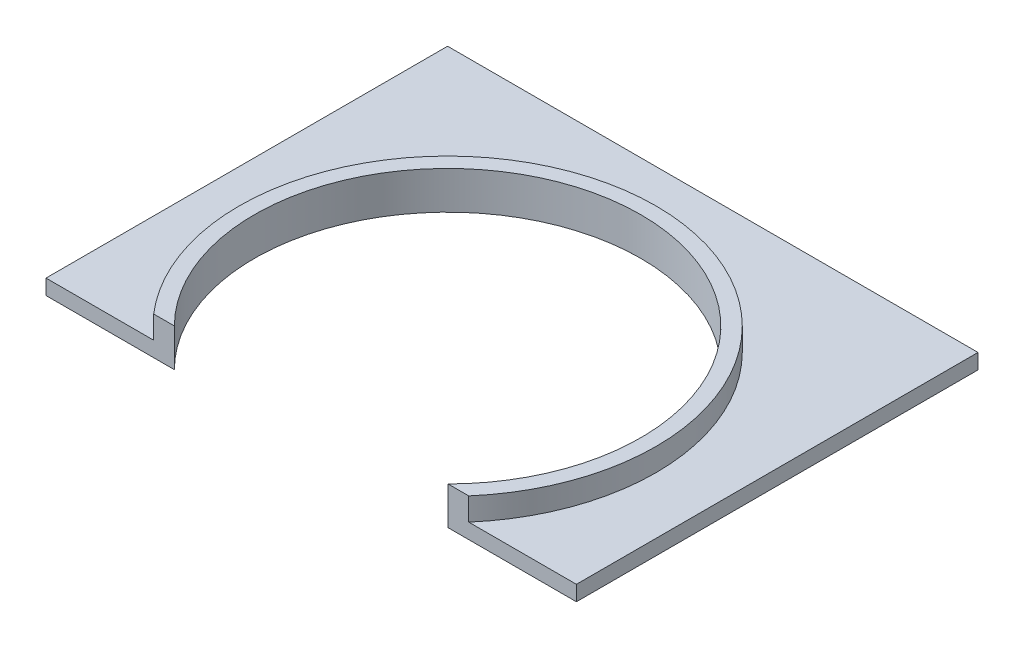
from build123d import *

# Parameters (mm, degrees)
CROQUIS1_W              = 70
CROQUIS1_H              = 70
CROQUIS1_R              = 25.5
SALIENTE_EXTRUIR1_DEPTH = 2
CROQUIS2_R              = 27.5
CROQUIS2_R_2            = 25.5
SALIENTE_EXTRUIR2_DEPTH = 3
CROQUIS3_W              = 70
CROQUIS3_H              = 17
CORTAR_EXTRUIR1_DEPTH   = 50.749371855


with BuildPart() as part:
    # Croquis1 → Saliente-Extruir1 (new body)
    with BuildSketch(Plane(origin=(0, 0, 0), x_dir=(1, 0, 0), z_dir=(0, 1, 0))):
        Rectangle(CROQUIS1_W, CROQUIS1_H)
        with Locations(Location((0, 0, 0), (0, 0, 270))):
            Circle(CROQUIS1_R, mode=Mode.SUBTRACT)
    extrude(amount=SALIENTE_EXTRUIR1_DEPTH)

    # Croquis2 → Saliente-Extruir2 (add)
    with BuildSketch(Plane(origin=(0, 2, 0), x_dir=(1, 0, 0), z_dir=(0, 1, 0))):
        with Locations(Location((0, 0, 0), (0, 0, 270))):
            Circle(CROQUIS2_R)
        with Locations(Location((0, 0, 0), (0, 0, 270))):
            Circle(CROQUIS2_R_2, mode=Mode.SUBTRACT)
    extrude(amount=SALIENTE_EXTRUIR2_DEPTH)

    # Croquis3 → Cortar-Extruir1 (cut, through all)
    with BuildSketch(Plane(origin=(0, 5, 0), x_dir=(1, 0, 0), z_dir=(0, 1, 0))):
        with Locations((0, -26.5)):
            Rectangle(CROQUIS3_W, CROQUIS3_H)
    extrude(amount=-CORTAR_EXTRUIR1_DEPTH, mode=Mode.SUBTRACT)


solid = part.part
